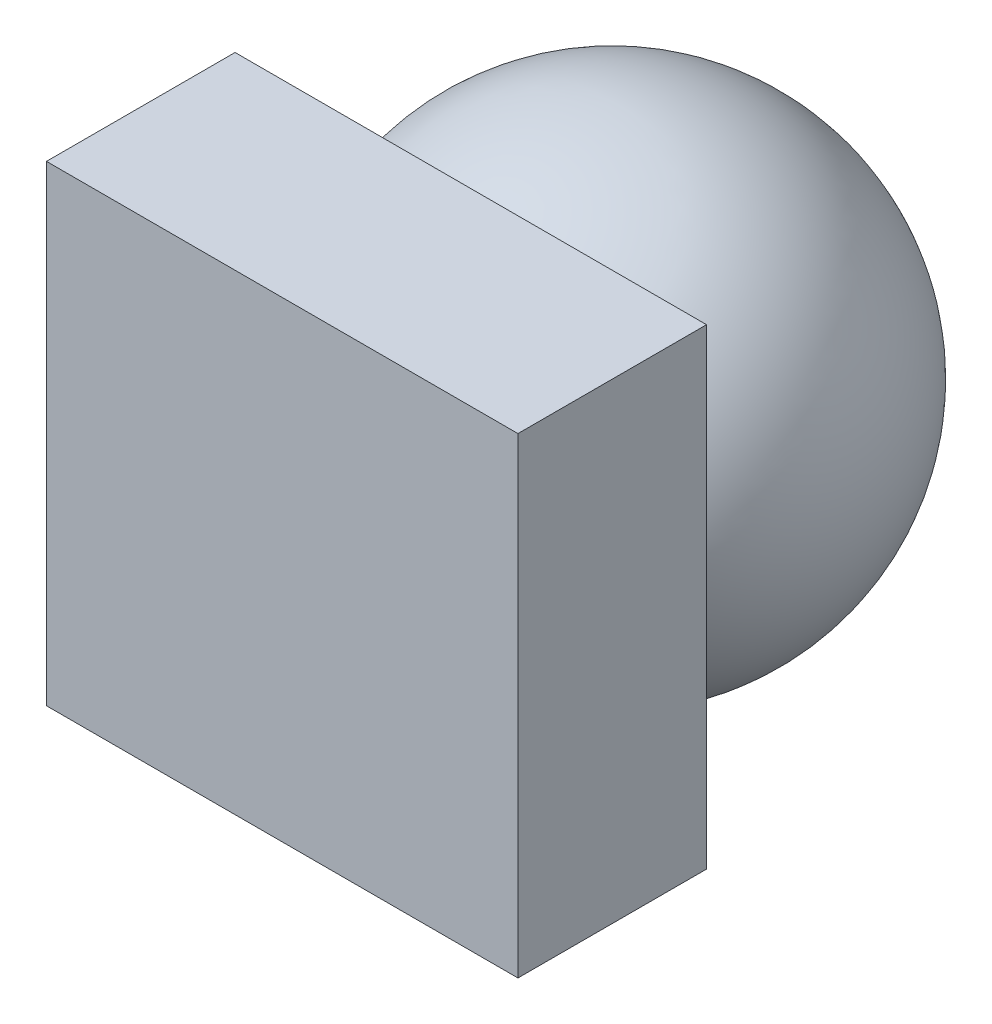
from build123d import *

# Parameters (mm, degrees)
SKETCH1_W           = 25
SKETCH1_H           = 25
BOSS_EXTRUDE1_DEPTH = 10


with BuildPart() as part:
    # Sketch1 → Boss-Extrude1 (new body)
    with BuildSketch(Plane.XY):
        with Locations((12.5, 12.5)):
            Rectangle(SKETCH1_W, SKETCH1_H)
    extrude(amount=BOSS_EXTRUDE1_DEPTH)

    # Sketch3 → Revolve1 (revolve)
    with BuildSketch(Plane(origin=(0, 12.5, 0), x_dir=(-1, 0, 0), z_dir=(0, -1, 0))):
        with BuildLine():
            Line((-12.5, 20), (-12.5, -5))
            ThreePointArc((-12.5, -5), (0, 7.5), (-12.5, 20))
        make_face()
    revolve(axis=Axis((12.5, 12.5, 0), (0, 0, 1)))


solid = part.part
